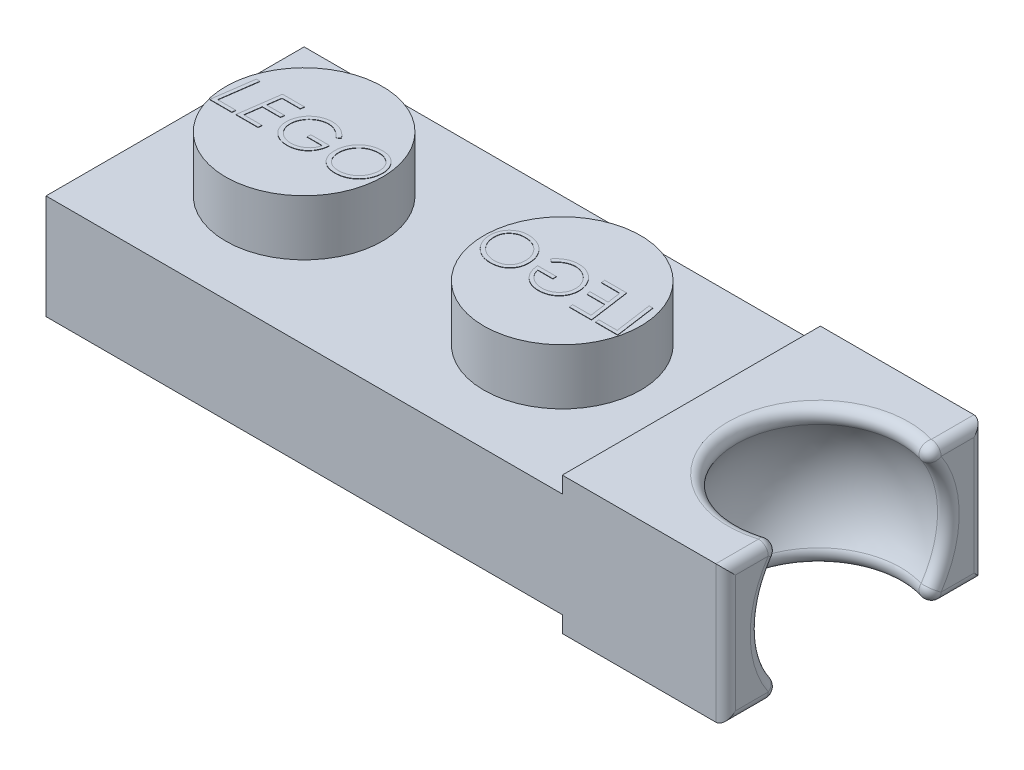
from build123d import *

# Parameters (mm, degrees)
SKETCH1_W           = 7.9
SKETCH1_H           = 7.9
BOSS_EXTRUDE1_DEPTH = 3.2
SKETCH2_R           = 2.4
BOSS_EXTRUDE2_DEPTH = 1.7
BOSS_EXTRUDE4_DEPTH = 0.01
SKETCH4_W           = 6.679581062
SKETCH4_H           = 6.679581062
CUT_EXTRUDE1_DEPTH  = 2.01
BOSS_EXTRUDE5_START = -2.01
BOSS_EXTRUDE5_DEPTH = 2.01
SKETCH6_W           = 7.9
SKETCH6_H           = 4.2
BOSS_EXTRUDE6_DEPTH = 5
FILLET1_R           = 0.3


with BuildPart() as part:
    # Sketch1 → Boss-Extrude1 (new body)
    with BuildSketch(Plane(origin=(0, 0, 0), x_dir=(1, 0, 0), z_dir=(0, 1, 0))):
        with Locations((3.95, 3.95)):
            Rectangle(SKETCH1_W, SKETCH1_H)
    extrude(amount=BOSS_EXTRUDE1_DEPTH)

    # Sketch2 → Boss-Extrude2 (add)
    with BuildSketch(Plane(origin=(0, 3.2, 0), x_dir=(1, 0, 0), z_dir=(0, 1, 0))):
        with Locations(Location((3.95, 3.95, 0), (0, 0, 270))):
            Circle(SKETCH2_R)
    extrude(amount=BOSS_EXTRUDE2_DEPTH)

    # Sketch3 → Boss-Extrude4 (add)
    # profile 1 of 4: a face of its own
    with BuildSketch(Plane(origin=(0, 4.9, 0), x_dir=(1, 0, 0), z_dir=(0, 1, 0))):
        Polygon((1.832282536, 4.604898123), (1.945463626, 4.604898123), (1.785708017, 3.46707761), (2.346104652, 3.46707761), (2.331831815, 3.354898123), (1.657002088, 3.354898123), align=None)
    # profile 2 of 4: a face of its own
    with BuildSketch(Plane(origin=(0, 4.9, 0), x_dir=(1, 0, 0), z_dir=(0, 1, 0))):
        Polygon((3.307643113, 4.604898123), (3.289864668, 4.492718636), (2.730720036, 4.492718636), (2.672376687, 4.076051969), (3.227514908, 4.076051969), (3.211489267, 3.963872482), (2.656351046, 3.963872482), (2.586990069, 3.46707761), (3.147386703, 3.46707761), (3.132863466, 3.354898123), (2.458284139, 3.354898123), (2.633564588, 4.604898123), align=None)
    # profile 3 of 4: a face of its own
    with BuildSketch(Plane(origin=(0, 4.9, 0), x_dir=(1, 0, 0), z_dir=(0, 1, 0))):
        with BuildLine():
            Line((4.701873883, 4.341727049), (4.602214428, 4.268359661))
            add(Edge.make_bspline(
                [(4.602214428, 4.268359661), (4.594223081, 4.278463296), (4.578382454, 4.298490949), (4.552974208, 4.326751799), (4.526781942, 4.353389692), (4.49925824, 4.377917229), (4.471083571, 4.40112998), (4.441525281, 4.42204341), (4.410978563, 4.441207159), (4.379659496, 4.458649755), (4.347610579, 4.474125482), (4.315396207, 4.487732834), (4.282869127, 4.498922357), (4.250283005, 4.50864136), (4.217299487, 4.51587276), (4.18414763, 4.520710487), (4.150903008, 4.524293062), (4.128633082, 4.524610402), (4.117438786, 4.524769918)],
                knots=[0, 0, 0, 0, 1.088205139, 2.157064813, 3.209299296, 4.24303109, 5.270682624, 6.292193363, 7.299904734, 8.316436989, 9.319473328, 10.305733085, 11.269264382, 12.22444877, 13.177574148, 14.119122834, 15.054550362, 16, 16, 16, 16], degree=3))
            add(Edge.make_bspline(
                [(4.117438786, 4.524769918), (4.104994375, 4.524521107), (4.080132736, 4.524024028), (4.043033101, 4.520256885), (4.006376299, 4.51354748), (3.969908323, 4.504926578), (3.933893833, 4.493301772), (3.898252767, 4.479273564), (3.86309309, 4.462612711), (3.828430169, 4.443710217), (3.794953431, 4.422557236), (3.762954424, 4.399818018), (3.733183783, 4.375017311), (3.704650221, 4.34913067), (3.678490591, 4.320990985), (3.654040353, 4.291325456), (3.631570613, 4.259970376), (3.610753816, 4.22729124), (3.592321888, 4.193377608), (3.576332398, 4.158696131), (3.562301633, 4.123622124), (3.551463822, 4.087613068), (3.542488613, 4.051135011), (3.536702509, 4.013925289), (3.532682003, 3.976230124), (3.532229884, 3.950862463), (3.532002088, 3.938081216)],
                knots=[0, 0, 0, 0, 0.97704485, 1.95195533, 2.923843304, 3.901415526, 4.89212417, 5.89249681, 6.906854198, 7.94508701, 8.99059592, 10.014519948, 11.024825533, 12.031297736, 13.037428488, 14.038509295, 15.047964276, 16.064309815, 17.079005887, 18.075937854, 19.061713623, 20.042247028, 21.026191147, 22.008802999, 22.996754876, 24, 24, 24, 24], degree=3))
            add(Edge.make_bspline(
                [(3.532002088, 3.938081216), (3.532369323, 3.920940483), (3.533092921, 3.887166428), (3.54080397, 3.83756171), (3.552297071, 3.789703796), (3.569345009, 3.743984102), (3.590663785, 3.700113704), (3.616898701, 3.658340736), (3.647995923, 3.618632516), (3.683169388, 3.581124089), (3.721975609, 3.547190184), (3.762989457, 3.517071082), (3.806208637, 3.491553815), (3.851780792, 3.471217023), (3.899058754, 3.454481236), (3.948703848, 3.443615036), (4.000192874, 3.436168993), (4.035279814, 3.435410998), (4.053085822, 3.435026328)],
                knots=[0, 0, 0, 0, 1.019699772, 2.00921373, 2.981850619, 3.945611549, 4.907936516, 5.881372837, 6.876399243, 7.906447893, 8.938173367, 9.941073143, 10.932270214, 11.919723139, 12.908225854, 13.912405215, 14.940582182, 16, 16, 16, 16], degree=3))
            add(Edge.make_bspline(
                [(4.053085822, 3.435026328), (4.074581254, 3.435599426), (4.11748625, 3.436743331), (4.180872469, 3.447608002), (4.243162184, 3.464003995), (4.303115661, 3.48756372), (4.359892332, 3.516274774), (4.411741714, 3.54979345), (4.457784869, 3.587961635), (4.498384943, 3.630580026), (4.53303885, 3.678554542), (4.563120551, 3.731230233), (4.587740602, 3.789373269), (4.599634966, 3.830601123), (4.605720036, 3.851692995)],
                knots=[0, 0, 0, 0, 1.033792167, 2.063454529, 3.086685911, 4.12966393, 5.157365104, 6.144632769, 7.094686579, 8.02963692, 8.969786061, 9.935985671, 10.944065236, 12, 12, 12, 12], degree=3))
            Line((4.605720036, 3.851692995), (4.140976447, 3.851692995))
            Line((4.140976447, 3.851692995), (4.140976447, 3.963872482))
            Line((4.140976447, 3.963872482), (4.717899524, 3.963872482))
            add(Edge.make_bspline(
                [(4.717899524, 3.963872482), (4.715864452, 3.940537279), (4.711874195, 3.894782885), (4.69942647, 3.828086612), (4.68199329, 3.764774229), (4.659173945, 3.704861641), (4.630919519, 3.648505742), (4.59774963, 3.595348644), (4.559285746, 3.545571633), (4.515814341, 3.499721655), (4.46844757, 3.458302738), (4.417878433, 3.421925394), (4.364351012, 3.391393009), (4.308182236, 3.366007973), (4.248908241, 3.346854494), (4.187007442, 3.33278705), (4.12217798, 3.324364805), (4.078067373, 3.323359246), (4.055589828, 3.322846841)],
                knots=[0, 0, 0, 0, 1.098006248, 2.152910829, 3.176693714, 4.174102283, 5.154427425, 6.128677043, 7.108165613, 8.099464247, 9.087077226, 10.054952015, 11.015803916, 11.972468591, 12.940477937, 13.931877037, 14.946141749, 16, 16, 16, 16], degree=3))
            add(Edge.make_bspline(
                [(4.055589828, 3.322846841), (4.032525547, 3.323342362), (3.987411429, 3.324311611), (3.9214857, 3.332876212), (3.858807865, 3.34620412), (3.799404334, 3.365318809), (3.743277296, 3.389857102), (3.690679177, 3.420179827), (3.641268759, 3.455657405), (3.595689928, 3.496348401), (3.554559756, 3.541197331), (3.518567584, 3.589307242), (3.487743642, 3.639999747), (3.462901044, 3.693721351), (3.443468533, 3.750181555), (3.429856098, 3.809437188), (3.421311108, 3.871476007), (3.420325278, 3.913764014), (3.419822601, 3.935326809)],
                knots=[0, 0, 0, 0, 1.117903688, 2.186638197, 3.21780727, 4.221242465, 5.20706516, 6.182431358, 7.159609539, 8.151436913, 9.139682433, 10.10533578, 11.060397566, 12.011007066, 12.969638005, 13.950363306, 14.954883424, 16, 16, 16, 16], degree=3))
            add(Edge.make_bspline(
                [(3.419822601, 3.935326809), (3.420138952, 3.950859376), (3.420767729, 3.981731803), (3.424963713, 4.027616327), (3.432679126, 4.072646659), (3.442852825, 4.116910735), (3.455965552, 4.160496846), (3.471933961, 4.20328178), (3.491087489, 4.245242481), (3.513047729, 4.286115161), (3.537530339, 4.325600602), (3.564271155, 4.363247138), (3.593498243, 4.398542313), (3.624507556, 4.432098501), (3.658146201, 4.463054417), (3.693847346, 4.491888255), (3.731480716, 4.518905381), (3.77142415, 4.543221398), (3.812846375, 4.565137356), (3.855118915, 4.584605211), (3.898469674, 4.600573637), (3.942428974, 4.613905323), (3.987291028, 4.624144078), (4.032916476, 4.631801844), (4.079465257, 4.63599767), (4.110753822, 4.636631416), (4.12645321, 4.636949405)],
                knots=[0, 0, 0, 0, 1.01034602, 2.008157081, 2.993527994, 3.979930372, 4.960683832, 5.951959865, 6.948100503, 7.958563211, 8.967975239, 9.968308804, 10.959584837, 11.946808627, 12.938010319, 13.930059161, 14.930392727, 15.949048275, 16.969091794, 17.977364349, 18.973726886, 19.971641333, 20.963333569, 21.964771492, 22.978801278, 24, 24, 24, 24], degree=3))
            add(Edge.make_bspline(
                [(4.12645321, 4.636949405), (4.140647989, 4.63666956), (4.168739982, 4.636115737), (4.210476499, 4.63288549), (4.251380819, 4.627152534), (4.29129634, 4.618801418), (4.330484053, 4.608567941), (4.368675988, 4.59577053), (4.406070924, 4.580754735), (4.442474857, 4.563343269), (4.478143584, 4.543914061), (4.512619765, 4.521658579), (4.546625807, 4.497640881), (4.579591338, 4.471153536), (4.611552577, 4.442077414), (4.642675265, 4.410871755), (4.673242279, 4.377555225), (4.692243855, 4.353777591), (4.701873883, 4.341727049)],
                knots=[0, 0, 0, 0, 1.015105213, 2.008930748, 2.991454354, 3.966534974, 4.923490216, 5.886087319, 6.844809209, 7.803252371, 8.770243484, 9.747130909, 10.735853235, 11.746297741, 12.768902994, 13.824016992, 14.897208497, 16, 16, 16, 16], degree=3))
        make_face()
    # profile 4 of 4: a face of its own
    with BuildSketch(Plane(origin=(0, 4.9, 0), x_dir=(1, 0, 0), z_dir=(0, 1, 0))):
        with BuildLine():
            add(Edge.make_bspline(
                [(5.671925966, 4.636949405), (5.692400623, 4.63650345), (5.732667893, 4.635626396), (5.791703582, 4.627669814), (5.84816478, 4.614697282), (5.901922783, 4.596339067), (5.953136821, 4.572927607), (6.001690741, 4.544284414), (6.047399306, 4.510158163), (6.09025375, 4.471611385), (6.129154607, 4.429051867), (6.163160058, 4.383201547), (6.192058383, 4.334734533), (6.215910086, 4.283554512), (6.233823478, 4.229366588), (6.246743033, 4.172603876), (6.255145963, 4.113110877), (6.255950492, 4.072491917), (6.256361062, 4.051763107)],
                knots=[0, 0, 0, 0, 1.061681398, 2.087996504, 3.083659545, 4.062660971, 5.02945529, 5.999994507, 6.981138296, 7.983640916, 8.985844288, 9.966988076, 10.939736476, 11.908342154, 12.890058995, 13.894159216, 14.925339913, 16, 16, 16, 16], degree=3))
            add(Edge.make_bspline(
                [(6.256361062, 4.051763107), (6.25623821, 4.038988627), (6.255995471, 4.01374805), (6.253408976, 3.976225127), (6.249128591, 3.939561124), (6.243455349, 3.903597875), (6.235835613, 3.868539787), (6.226924527, 3.834140064), (6.216051359, 3.800598383), (6.20384118, 3.767696929), (6.189792262, 3.735595516), (6.173946521, 3.704324105), (6.15669213, 3.673663515), (6.137607818, 3.643838863), (6.11686312, 3.614849105), (6.094393683, 3.586665409), (6.070489857, 3.559187301), (6.044887258, 3.532733386), (6.018336956, 3.507212599), (5.990529993, 3.48355884), (5.962091012, 3.461350566), (5.932834084, 3.440746086), (5.90250067, 3.422121085), (5.871581935, 3.404690573), (5.839905885, 3.388861691), (5.807185809, 3.375183309), (5.773789823, 3.362832151), (5.739620564, 3.352089492), (5.704582969, 3.343076229), (5.668762424, 3.335500733), (5.632062087, 3.329787275), (5.594535036, 3.325855801), (5.556279304, 3.323200874), (5.530454147, 3.322965537), (5.51742877, 3.322846841)],
                knots=[0, 0, 0, 0, 1.057694632, 2.089855924, 3.112648636, 4.113725536, 5.103331559, 6.082381806, 7.055068159, 8.021768845, 8.98743121, 9.954922249, 10.923671581, 11.89959402, 12.885451751, 13.874212627, 14.883322035, 15.900071676, 16.921812937, 17.931632203, 18.921551953, 19.909055848, 20.892997665, 21.867769094, 22.84762411, 23.823252803, 24.802912784, 25.795362855, 26.787788858, 27.797679081, 28.826061376, 29.861826465, 30.921574152, 32, 32, 32, 32], degree=3))
            add(Edge.make_bspline(
                [(5.51742877, 3.322846841), (5.495540081, 3.323312388), (5.45279647, 3.324221496), (5.390401025, 3.331753811), (5.331466149, 3.34468508), (5.275615882, 3.361975519), (5.223270197, 3.38492417), (5.174339628, 3.412892082), (5.128783581, 3.445910526), (5.086763869, 3.483632016), (5.049135515, 3.525626819), (5.016044394, 3.570822838), (4.988418107, 3.619388761), (4.96538613, 3.670881503), (4.948106883, 3.725740589), (4.935156589, 3.783416472), (4.927613141, 3.844314319), (4.926699871, 3.88597706), (4.926232857, 3.907281937)],
                knots=[0, 0, 0, 0, 1.121422378, 2.189881799, 3.214223923, 4.209829567, 5.180887389, 6.136870002, 7.092517675, 8.058664933, 9.02481219, 9.976998316, 10.923432162, 11.882748215, 12.86205079, 13.865508147, 14.908495107, 16, 16, 16, 16], degree=3))
            add(Edge.make_bspline(
                [(4.926232857, 3.907281937), (4.92651465, 3.92390256), (4.927073619, 3.956871533), (4.931757127, 4.005792823), (4.939128338, 4.053761359), (4.950024433, 4.100549976), (4.963594459, 4.14639076), (4.979990494, 4.191253803), (5.000003008, 4.234848241), (5.022452359, 4.277389438), (5.047513645, 4.318359564), (5.07559856, 4.356880644), (5.105216605, 4.393691441), (5.137816677, 4.42780852), (5.172496353, 4.459796588), (5.209524734, 4.489546335), (5.248906172, 4.516814917), (5.290422211, 4.541753927), (5.333531205, 4.564369022), (5.378335052, 4.583562961), (5.424193072, 4.600182058), (5.471345954, 4.613795807), (5.519847317, 4.623918047), (5.569406413, 4.631466127), (5.620254649, 4.636113027), (5.6545551, 4.636668231), (5.671925966, 4.636949405)],
                knots=[0, 0, 0, 0, 1.027038055, 2.037251559, 3.03463374, 4.024476576, 5.003805404, 5.987972729, 6.973761106, 7.966047439, 8.95963362, 9.938921687, 10.910571097, 11.877553313, 12.852319973, 13.824735949, 14.81069978, 15.81041387, 16.816403723, 17.816876174, 18.82042938, 19.829469955, 20.847307225, 21.880377804, 22.926554263, 24, 24, 24, 24], degree=3))
        make_face()
        with BuildLine():
            add(Edge.make_bspline(
                [(5.671925966, 4.524769918), (5.65697579, 4.524545747), (5.627444828, 4.524102944), (5.583747158, 4.520086709), (5.541191397, 4.514393729), (5.499970629, 4.505322476), (5.459846772, 4.494612055), (5.421182876, 4.480527241), (5.383524652, 4.464643931), (5.34726264, 4.446055377), (5.312516644, 4.425361321), (5.279529586, 4.402463835), (5.248469657, 4.377453479), (5.219370347, 4.350164922), (5.191739723, 4.321307483), (5.166361885, 4.289965789), (5.142845474, 4.256628787), (5.121196386, 4.221501346), (5.10164712, 4.185107003), (5.08492909, 4.147719282), (5.070612165, 4.109847114), (5.058744989, 4.071497155), (5.049737471, 4.032481304), (5.043287884, 3.99291855), (5.039049877, 3.95269661), (5.03862585, 3.92565532), (5.038412344, 3.912039549)],
                knots=[0, 0, 0, 0, 1.093710758, 2.16039807, 3.20900896, 4.233234191, 5.246749975, 6.245527847, 7.241594159, 8.235879922, 9.224691631, 10.198908654, 11.171861231, 12.139893662, 13.116290872, 14.093089164, 15.087825051, 16.099756899, 17.110766713, 18.108591704, 19.094380672, 20.071961556, 21.043859171, 22.021859724, 23.00397114, 24, 24, 24, 24], degree=3))
            add(Edge.make_bspline(
                [(5.038412344, 3.912039549), (5.038625982, 3.900599914), (5.039049193, 3.877938292), (5.041777549, 3.844392517), (5.046595514, 3.811801965), (5.053065301, 3.780081073), (5.061542906, 3.749273697), (5.072183234, 3.719394567), (5.084405544, 3.690349568), (5.098393626, 3.662290632), (5.114175341, 3.635553687), (5.131389377, 3.61020951), (5.150226394, 3.586682218), (5.170360361, 3.564729612), (5.191972025, 3.544421151), (5.214980987, 3.52555365), (5.239648771, 3.508615875), (5.265465573, 3.492943288), (5.292687864, 3.479247808), (5.321165948, 3.467438697), (5.350786278, 3.457432665), (5.381544214, 3.449135171), (5.413524888, 3.442928532), (5.44663118, 3.438448028), (5.480905707, 3.435639812), (5.504152208, 3.435232585), (5.515926367, 3.435026328)],
                knots=[0, 0, 0, 0, 1.083699529, 2.146780792, 3.185591126, 4.202843058, 5.211856999, 6.209655863, 7.20532214, 8.195415879, 9.177202942, 10.14436246, 11.095191523, 12.029705806, 12.963818608, 13.902338257, 14.845476191, 15.796042213, 16.761390084, 17.729066592, 18.714222808, 19.721158958, 20.74459932, 21.797962164, 22.884686177, 24, 24, 24, 24], degree=3))
            add(Edge.make_bspline(
                [(5.515926367, 3.435026328), (5.530044188, 3.435228857), (5.558004277, 3.435629962), (5.599524853, 3.440000997), (5.64032433, 3.445959686), (5.680325762, 3.455225454), (5.71965402, 3.466535035), (5.757982705, 3.481070895), (5.795756024, 3.497476377), (5.83237428, 3.51683082), (5.867802238, 3.538111172), (5.901266528, 3.561837848), (5.932774032, 3.587459191), (5.962816859, 3.614626895), (5.990234918, 3.644356353), (6.016009711, 3.675809964), (6.039684501, 3.709331455), (6.061465654, 3.744601276), (6.080935982, 3.781209824), (6.097718361, 3.818903041), (6.112024773, 3.857287248), (6.123844079, 3.896320217), (6.132886835, 3.936161865), (6.139301688, 3.976648339), (6.14355343, 4.017951988), (6.143970816, 4.04574289), (6.144181575, 4.059775927)],
                knots=[0, 0, 0, 0, 1.029812959, 2.039525905, 3.043952503, 4.036919093, 5.033391511, 6.027870106, 7.026035071, 8.036794627, 9.047957848, 10.039952554, 11.027355318, 12.010276797, 12.992858524, 13.975534638, 14.976019862, 15.985163142, 16.99876328, 17.999396818, 18.993875413, 19.986244033, 20.973271002, 21.972624612, 22.976275263, 24, 24, 24, 24], degree=3))
            add(Edge.make_bspline(
                [(6.144181575, 4.059775927), (6.143688983, 4.077993105), (6.142724583, 4.113658826), (6.13551886, 4.16576722), (6.122807184, 4.214771606), (6.105892747, 4.261149785), (6.083400704, 4.304354629), (6.056090597, 4.344736825), (6.024020374, 4.382453222), (5.999069145, 4.404451295), (5.986429171, 4.415595238)],
                knots=[0, 0, 0, 0, 1.085318323, 2.124844004, 3.126009127, 4.096923137, 5.060061729, 6.020100862, 6.997008382, 8, 8, 8, 8], degree=3))
            add(Edge.make_bspline(
                [(5.986429171, 4.415595238), (5.97539623, 4.42431843), (5.953439426, 4.44167857), (5.917982347, 4.463870828), (5.881057133, 4.482788681), (5.842389242, 4.498145486), (5.802091847, 4.510165945), (5.760106575, 4.518646998), (5.716539836, 4.523741692), (5.686963766, 4.524423338), (5.671925966, 4.524769918)],
                knots=[0, 0, 0, 0, 0.992364662, 1.974918139, 2.947382948, 3.917989177, 4.907989082, 5.912266894, 6.938502841, 8, 8, 8, 8], degree=3))
        make_face(mode=Mode.SUBTRACT)
    extrude(amount=BOSS_EXTRUDE4_DEPTH)

    # Sketch4 → Cut-Extrude1 (cut)
    with BuildSketch(Plane.XZ):
        with Locations((3.960209469, -3.960209469)):
            Rectangle(SKETCH4_W, SKETCH4_H)
    extrude(amount=-CUT_EXTRUDE1_DEPTH, mode=Mode.SUBTRACT)

    # Sketch5 → Boss-Extrude5 (add)
    with BuildSketch(Plane(origin=(0, 3.2, 0), x_dir=(1, 0, 0), z_dir=(0, 1, 0)).offset(BOSS_EXTRUDE5_START)):
        with BuildLine():
            Line((6.369527619, 1.557811677), (5.363437843, 1.557811677))
            ThreePointArc((5.363437843, 1.557811677), (6.369527619, 0.551721901), (7.375617394, 1.557811677))
            ThreePointArc((7.375617394, 1.557811677), (7.080940521, 2.269224579), (6.369527619, 2.563901452))
            Line((6.369527619, 2.563901452), (6.369527619, 1.557811677))
        make_face()
        with BuildLine():
            Line((1.458127833, 2.579758881), (1.458127833, 1.557811677))
            Line((1.458127833, 1.557811677), (2.480075037, 1.557811677))
            ThreePointArc((2.480075037, 1.557811677), (2.180753631, 2.280437475), (1.458127833, 2.579758881))
        make_face()
        with BuildLine():
            Line((2.480075037, 1.557811677), (1.458127833, 1.557811677))
            Line((1.458127833, 1.557811677), (1.458127833, 2.579758881))
            ThreePointArc((1.458127833, 2.579758881), (0.735502035, 0.835185879), (2.480075037, 1.557811677))
        make_face()
        with BuildLine():
            ThreePointArc((5.605437996, 2.21232194), (5.425875301, 1.906719887), (5.363437843, 1.557811677))
            Line((5.363437843, 1.557811677), (6.369527619, 1.557811677))
            Line((6.369527619, 1.557811677), (6.369527619, 2.563901452))
            ThreePointArc((6.369527619, 2.563901452), (6.015263465, 2.499466361), (5.706377057, 2.31441459))
            ThreePointArc((5.706377057, 2.31441459), (5.656671092, 2.262613327), (5.605437996, 2.21232194))
        make_face()
        with BuildLine():
            ThreePointArc((7.385597221, 6.365232327), (6.369527619, 7.381301929), (5.353458016, 6.365232327))
            Line((5.353458016, 6.365232327), (6.369527619, 6.365232327))
            Line((6.369527619, 6.365232327), (6.369527619, 5.349162725))
            ThreePointArc((6.369527619, 5.349162725), (7.087997324, 5.646762621), (7.385597221, 6.365232327))
        make_face()
        with BuildLine():
            Line((6.369527619, 6.365232327), (5.353458016, 6.365232327))
            ThreePointArc((5.353458016, 6.365232327), (5.651057913, 5.646762621), (6.369527619, 5.349162725))
            Line((6.369527619, 5.349162725), (6.369527619, 6.365232327))
        make_face()
        with BuildLine():
            ThreePointArc((2.499242709, 6.365232327), (0.721948444, 7.101411716), (1.458127833, 5.324117451))
            Line((1.458127833, 5.324117451), (1.458127833, 6.365232327))
            Line((1.458127833, 6.365232327), (2.499242709, 6.365232327))
        make_face()
        with BuildLine():
            Line((1.458127833, 6.365232327), (1.458127833, 5.324117451))
            ThreePointArc((1.458127833, 5.324117451), (2.194307222, 5.629052938), (2.499242709, 6.365232327))
            Line((2.499242709, 6.365232327), (1.458127833, 6.365232327))
        make_face()
    extrude(amount=BOSS_EXTRUDE5_DEPTH)

    # Mirror1: part across plane


with BuildPart() as part_1:
    add(part.part)
    add(part.part.mirror(Plane(origin=(7.9, 3.2, 0), x_dir=(0, 0, 1), z_dir=(-1, 0, 0))))

    # Sketch6 → Boss-Extrude6 (add)
    with BuildSketch(Plane(origin=(15.8, 0, 0), x_dir=(0, 0, -1), z_dir=(1, 0, 0))):
        with Locations((3.95, 1.6)):
            Rectangle(SKETCH6_W, SKETCH6_H)
    extrude(amount=BOSS_EXTRUDE6_DEPTH)

    # Sketch13 → Cut-Revolve1 (revolve, cut)
    with BuildSketch(Plane(origin=(0, 1.6, 0), x_dir=(1, 0, 0), z_dir=(0, 1, 0))):
        with BuildLine():
            Line((19.688949017, 0.95), (19.688949017, 6.95))
            ThreePointArc((19.688949017, 6.95), (16.688949017, 3.95), (19.688949017, 0.95))
        make_face()
    revolve(axis=Axis((19.688949017, 1.6, -0.95), (0, 0, -1)), mode=Mode.SUBTRACT)

    # Fillet1
    fillet1_edges = [part_1.edges().sort_by_distance(p)[0] for p in [
        (20.8, 1.6, 0),
        (20.8, -0.5, -1.059089836),
        (20.8, 1.6, -7.9),
        (20.8, 3.7, -6.840910164),
        (20.8, -0.5, -6.840910164),
        (20.8, 3.7, -1.059089836),
        (20.8, 1.6, -1.163323537),
        (20.8, 1.6, -6.736676463),
        (17.546520488, -0.5, -3.95),
        (17.546520488, 3.7, -3.95),
    ]]
    fillet(fillet1_edges, radius=FILLET1_R)


solid = part_1.part
